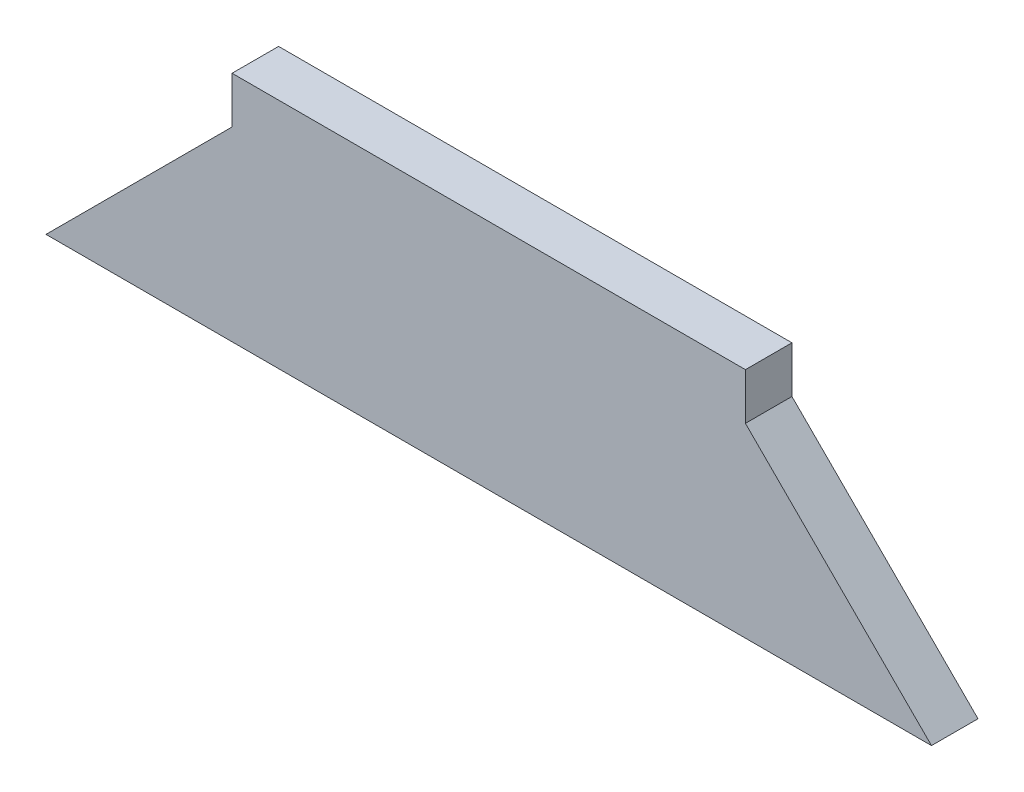
from build123d import *

# Parameters (mm, degrees)
SALIENTE_EXTRUIR1_DEPTH = 3


with BuildPart() as part:
    # Croquis1 → Saliente-Extruir1 (new body)
    with BuildSketch(Plane.XY):
        Polygon((-16.555, 7), (-28.555, -5), (28.555, -5), (16.555, 7), (16.555, 10), (-16.555, 10), align=None)
    extrude(amount=SALIENTE_EXTRUIR1_DEPTH)


solid = part.part
